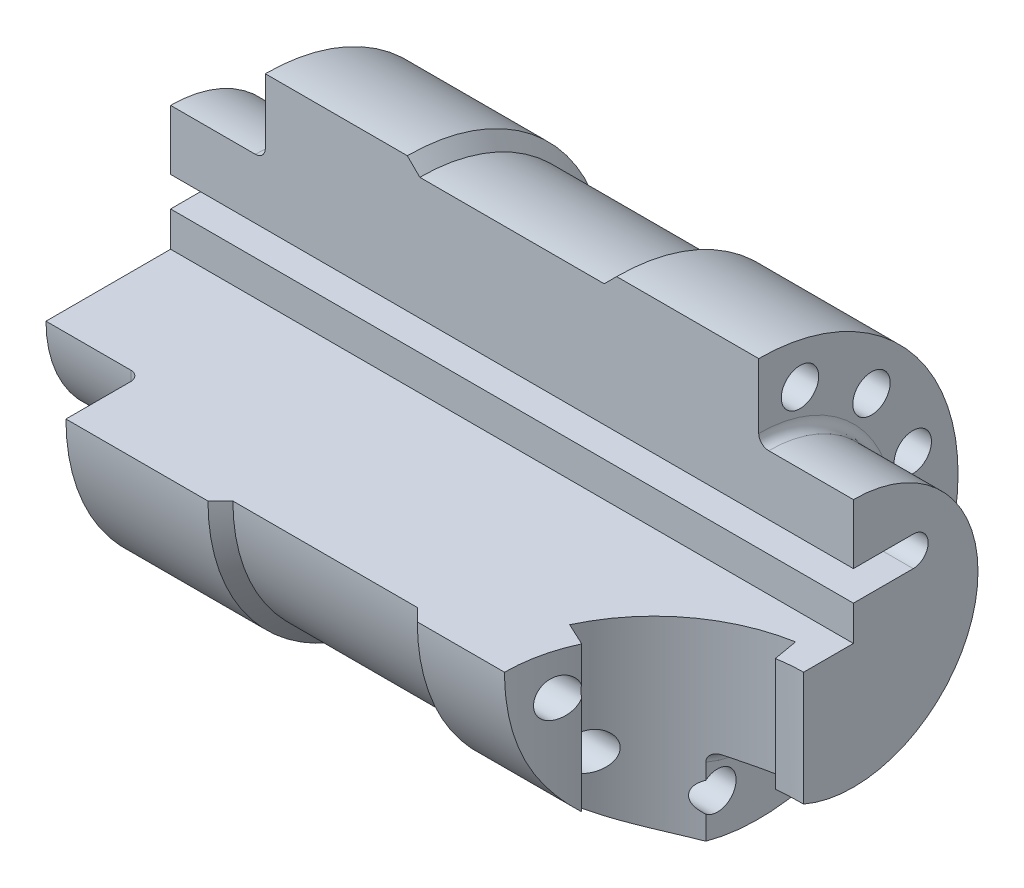
from build123d import *

# Parameters (mm, degrees)
ENL_V_MAT_EXTRU_1_DEPTH = 149.219431924
ESQUISSE3_R             = 3.75
ENL_V_MAT_EXTRU_2_DEPTH = 131.858702424
ENL_V_MAT_EXTRU_3_DEPTH = 126.862394907
ENL_V_MAT_EXTRU_4_DEPTH = 10
CONG_1_R                = 1


with BuildPart() as part:
    # Esquisse1 → Révolution1 (revolve)
    with BuildSketch(Plane.XY, mode=Mode.PRIVATE) as r_volution1_sk:
        with BuildLine():
            Line((0, 0), (24.566275292, 0))
            Line((24.566275292, 0), (24.566275292, 25))
            Line((24.566275292, 25), (7.566275292, 25))
            ThreePointArc((7.566275292, 25), (6.152061729, 25.585786438), (5.566275292, 27))
            Line((5.566275292, 27), (5.566275292, 40))
            Line((5.566275292, 40), (-22.933724708, 40))
            Line((-22.933724708, 40), (-25.433724708, 37.5))
            Line((-25.433724708, 37.5), (-62.433724708, 37.5))
            Line((-62.433724708, 37.5), (-64.933724708, 40))
            Line((-64.933724708, 40), (-93.433724708, 40))
            Line((-93.433724708, 40), (-93.433724708, 27))
            ThreePointArc((-93.433724708, 27), (-94.019511146, 25.585786438), (-95.433724708, 25))
            Line((-95.433724708, 25), (-112.433724708, 25))
            Line((-112.433724708, 25), (-112.433724708, 0))
            Line((-112.433724708, 0), (0, 0))
        make_face()
    revolve(r_volution1_sk.sketch.rotate(Axis((-130.768922499, 0, 0), (1, 0, 0)), 90), axis=Axis((-130.768922499, 0, 0), (1, 0, 0)))

    # Esquisse2 → Enlèv. mat.-Extru.1 (cut, through all)
    with BuildSketch(Plane.ZY.offset(112.433724708)):
        with BuildLine():
            Line((0, 7), (0, 0))
            Line((0, 0), (43.449782835, 0))
            Line((43.449782835, 0), (43.449782835, 44.497429883))
            Line((43.449782835, 44.497429883), (0, 44.497429883))
            Line((0, 44.497429883), (0, 13))
            ThreePointArc((0, 13), (3, 10), (0, 7))
        make_face()
        with BuildLine():
            Line((-12, 7), (0, 7))
            ThreePointArc((0, 7), (3, 10), (0, 13))
            Line((0, 13), (-12, 13))
            ThreePointArc((-12, 13), (-15, 10), (-12, 7))
        make_face()
    extrude(amount=-ENL_V_MAT_EXTRU_1_DEPTH, mode=Mode.SUBTRACT)

    # Esquisse3 → Enlèv. mat.-Extru.2 (cut, through all)
    with BuildSketch(Plane.ZY.offset(93.433724708)):
        with Locations((-8.282209443, 30.909626441)):
            Circle(ESQUISSE3_R)
        with Locations((-22.627416998, 22.627416998)):
            Circle(ESQUISSE3_R)
        with Locations((-30.909626441, 8.282209443)):
            Circle(ESQUISSE3_R)
        with Locations((-30.909626441, -8.282209443)):
            Circle(ESQUISSE3_R)
        with Locations((-22.627416998, -22.627416998)):
            Circle(ESQUISSE3_R)
        with Locations((-8.282209443, -30.909626441)):
            Circle(ESQUISSE3_R)
        with Locations((8.282209443, -30.909626441)):
            Circle(ESQUISSE3_R)
        with Locations((22.627416998, -22.627416998)):
            Circle(ESQUISSE3_R)
        with Locations((30.909626441, -8.282209443)):
            Circle(ESQUISSE3_R)
    extrude(amount=-ENL_V_MAT_EXTRU_2_DEPTH, mode=Mode.SUBTRACT)

    # Esquisse4 → Enlèv. mat.-Extru.3 (cut, through all)
    with BuildSketch(Plane(origin=(0, 0, 0), x_dir=(1, 0, 0), z_dir=(0, 1, 0))):
        with BuildLine():
            Line((5.566275292, -31.140154495), (24.566275292, -40))
            Line((24.566275292, -40), (21.921370581, -25))
            Line((21.921370581, -25), (7.566275292, -25))
            ThreePointArc((7.566275292, -25), (6.152061729, -25.585786438), (5.566275292, -27))
            Line((5.566275292, -27), (5.566275292, -31.140154495))
        make_face()
        with BuildLine():
            Line((-5.433724708, -40), (5.566275292, -40))
            Line((5.566275292, -40), (5.566275292, -31.140154495))
            Line((5.566275292, -31.140154495), (-2.622958319, -27.321452148))
            ThreePointArc((-2.622958319, -27.321452148), (-4.722604922, -33.506811582), (-5.433724708, -40))
        make_face()
        with BuildLine():
            Line((-2.622958319, -27.321452148), (5.566275292, -31.140154495))
            Line((5.566275292, -31.140154495), (5.566275292, -27))
            ThreePointArc((5.566275292, -27), (6.152061729, -25.585786438), (7.566275292, -25))
            Line((7.566275292, -25), (21.921370581, -25))
            Line((21.921370581, -25), (19.356829962, -10.45576741))
            ThreePointArc((19.356829962, -10.45576741), (6.303432421, -16.199399791), (-2.622958319, -27.321452148))
        make_face()
        Polygon((5.566275292, -40), (24.566275292, -40), (5.566275292, -31.140154495), align=None)
        with BuildLine():
            Line((-7.154497255, -25.208360839), (-2.622958319, -27.321452148))
            ThreePointArc((-2.622958319, -27.321452148), (6.303432421, -16.199399791), (19.356829962, -10.45576741))
            Line((19.356829962, -10.45576741), (18.488589073, -5.531728645))
            ThreePointArc((18.488589073, -5.531728645), (3.259625276, -12.23263309), (-7.154497255, -25.208360839))
        make_face()
        with BuildLine():
            Line((21.921370581, -25), (24.566275292, -25))
            Line((24.566275292, -25), (24.566275292, -10))
            ThreePointArc((24.566275292, -10), (21.951603009, -10.114159057), (19.356829962, -10.45576741))
            Line((19.356829962, -10.45576741), (21.921370581, -25))
        make_face()
        Polygon((21.921370581, -25), (24.566275292, -40), (24.566275292, -25), align=None)
    extrude(amount=-ENL_V_MAT_EXTRU_3_DEPTH, mode=Mode.SUBTRACT)

    # Esquisse5 → Enlèv. mat.-Extru.4 (cut)
    with BuildSketch(Plane.ZY.offset(112.433724708)):
        with BuildLine():
            Line((20.615528128, -4), (-4, -4))
            Line((-4, -4), (-4, 3))
            Line((-4, 3), (-20.784609691, 3))
            ThreePointArc((-20.784609691, 3), (-3.501020872, -20.706106656), (20.615528128, -4))
        make_face()
    extrude(amount=-ENL_V_MAT_EXTRU_4_DEPTH, mode=Mode.SUBTRACT)

    # Congé1
    cong_1_edges = [part.edges().sort_by_distance(p)[0] for p in [
        (-102.433724708, -20.706106656, -3.501020872),
        (-102.433724708, 3, -12.392304845),
        (-102.433724708, -0.5, -4),
        (-102.433724708, -4, 8.307764064),
    ]]
    fillet(cong_1_edges, radius=CONG_1_R)


solid = part.part
